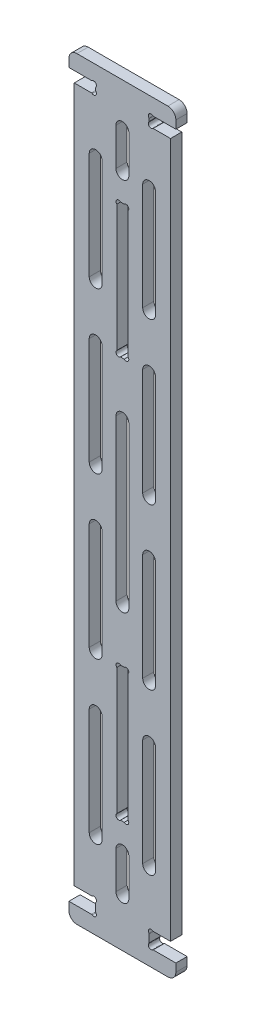
from build123d import *

# Parameters (mm, degrees)
SKETCH_1_W          = 18
SKETCH_1_H          = 130
SKETCH_1_W_2        = 5
SKETCH_1_H_2        = 2
SKETCH_1_H_3        = 3
EXTRUDE_1_DEPTH     = 1.05
SKETCH_5_R          = 0.5
CUT_EXTRUDE_3_DEPTH = 69.625141166
SKETCH_2_W          = 1.05
SKETCH_2_H          = 25.1
CUT_EXTRUDE_1_DEPTH = 10
SKETCH_6_R          = 0.5
CUT_EXTRUDE_4_DEPTH = 69.625141166
CUT_EXTRUDE_5_DEPTH = 69.625141166
CUT_EXTRUDE_6_DEPTH = 69.625141166
EXTRUDE_2_DEPTH     = 2.1
CUT_EXTRUDE_7_DEPTH = 72.731513298
FILLET_1_R          = 0.2
FILLET_2_R          = 1.5
FILLET_3_R          = 0.2


with BuildPart() as part:
    # 草图1 → 凸台-拉伸1 (new, symmetric)
    with BuildSketch(Plane.XY):
        Rectangle(SKETCH_1_W, SKETCH_1_H)
        with Locations((-2.5, 66)):
            Rectangle(SKETCH_1_W_2, SKETCH_1_H_2)
        with Locations((2.5, 66)):
            Rectangle(SKETCH_1_W_2, SKETCH_1_H_2)
        with Locations((2.5, -66.5)):
            Rectangle(SKETCH_1_W_2, SKETCH_1_H_3)
        with Locations((-2.5, -66.5)):
            Rectangle(SKETCH_1_W_2, SKETCH_1_H_3)
    extrude(amount=EXTRUDE_1_DEPTH, both=True)

    # 草图5 → 切除-拉伸3 (cut, through all)
    with BuildSketch(Plane.XY.offset(1.05)):
        with Locations((5.353553391, 65.353553391)):
            Circle(SKETCH_5_R)
        with Locations((-5.353553391, 65.353553391)):
            Circle(SKETCH_5_R)
        with Locations((5.353553391, -65.353553391)):
            Circle(SKETCH_5_R)
        with Locations((-5.353553391, -65.353553391)):
            Circle(SKETCH_5_R)
    extrude(amount=-CUT_EXTRUDE_3_DEPTH, mode=Mode.SUBTRACT)

    # 草图2 → 切除-拉伸1 (cut)
    with BuildSketch(Plane.XY.offset(1.05)):
        with Locations((0.525, 37.5)):
            Rectangle(SKETCH_2_W, SKETCH_2_H)
        with Locations((-0.525, 37.5)):
            Rectangle(SKETCH_2_W, SKETCH_2_H)
        with Locations((0.525, -37.5)):
            Rectangle(SKETCH_2_W, SKETCH_2_H)
        with Locations((-0.525, -37.5)):
            Rectangle(SKETCH_2_W, SKETCH_2_H)
    extrude(amount=-CUT_EXTRUDE_1_DEPTH, mode=Mode.SUBTRACT)

    # 草图6 → 切除-拉伸4 (cut, through all)
    with BuildSketch(Plane.XY.offset(1.05)):
        with Locations((0.696446609, 49.696446609)):
            Circle(SKETCH_6_R)
        with Locations((-0.696446609, 49.696446609)):
            Circle(SKETCH_6_R)
        with Locations((0.696446609, 25.303553391)):
            Circle(SKETCH_6_R)
        with Locations((-0.696446609, 25.303553391)):
            Circle(SKETCH_6_R)
    cut_extrude_4 = extrude(amount=-CUT_EXTRUDE_4_DEPTH, mode=Mode.SUBTRACT)

    # 镜向1: 切除-拉伸4 across plane
    add(cut_extrude_4.mirror(Plane.ZX), mode=Mode.SUBTRACT)

    # 草图4 → 切除-拉伸5 (cut, through all)
    with BuildSketch(Plane.XY.offset(1.05)):
        with BuildLine():
            Line((6.2, 55), (6.2, 35))
            ThreePointArc((6.2, 35), (5, 33.8), (3.8, 35))
            Line((3.8, 35), (3.8, 55))
            ThreePointArc((3.8, 55), (5, 56.2), (6.2, 55))
        make_face()
        with BuildLine():
            Line((6.2, 25), (6.2, 5))
            ThreePointArc((6.2, 5), (5, 3.8), (3.8, 5))
            Line((3.8, 5), (3.8, 25))
            ThreePointArc((3.8, 25), (5, 26.2), (6.2, 25))
        make_face()
        with BuildLine():
            Line((6.2, -5), (6.2, -25))
            ThreePointArc((6.2, -25), (5, -26.2), (3.8, -25))
            Line((3.8, -25), (3.8, -5))
            ThreePointArc((3.8, -5), (5, -3.8), (6.2, -5))
        make_face()
        with BuildLine():
            Line((3.8, -55), (3.8, -35))
            ThreePointArc((3.8, -35), (5, -33.8), (6.2, -35))
            Line((6.2, -35), (6.2, -55))
            ThreePointArc((6.2, -55), (5, -56.2), (3.8, -55))
        make_face()
    cut_extrude_5 = extrude(amount=-CUT_EXTRUDE_5_DEPTH, mode=Mode.SUBTRACT)

    # 镜向2: 切除-拉伸5 across plane
    add(cut_extrude_5.mirror(Plane(origin=(0, 0, 0), x_dir=(0, 0, 1), z_dir=(1, 0, 0))), mode=Mode.SUBTRACT)

    # 草图7 → 切除-拉伸6 (cut, through all)
    with BuildSketch(Plane.XY.offset(1.05)):
        with BuildLine():
            Line((1.2, 62.05), (1.2, 55.05))
            ThreePointArc((1.2, 55.05), (0, 53.85), (-1.2, 55.05))
            Line((-1.2, 55.05), (-1.2, 62.05))
            ThreePointArc((-1.2, 62.05), (0, 63.25), (1.2, 62.05))
        make_face()
        with BuildLine():
            Line((1.2, 15), (1.2, -15))
            ThreePointArc((1.2, -15), (0, -16.2), (-1.2, -15))
            Line((-1.2, -15), (-1.2, 15))
            ThreePointArc((-1.2, 15), (0, 16.2), (1.2, 15))
        make_face()
        with BuildLine():
            Line((1.2, -55.05), (1.2, -62.05))
            ThreePointArc((1.2, -62.05), (0, -63.25), (-1.2, -62.05))
            Line((-1.2, -62.05), (-1.2, -55.05))
            ThreePointArc((-1.2, -55.05), (0, -53.85), (1.2, -55.05))
        make_face()
    extrude(amount=-CUT_EXTRUDE_6_DEPTH, mode=Mode.SUBTRACT)

    # 草图8 → 凸台-拉伸2 (add)
    with BuildSketch(Plane.XY.offset(1.05)):
        Polygon((5, -68), (10, -68), (10, -71), (-10, -71), (-10, -68), (-5, -68), align=None)
        Polygon((5, 67), (10, 67), (10, 70), (-10, 70), (-10, 67), (-5, 67), align=None)
    extrude(amount=-EXTRUDE_2_DEPTH)

    # 草图9 → 切除-拉伸7 (cut, through all)
    with BuildSketch(Plane(origin=(0, 0, -1.05), x_dir=(-1, 0, 0), z_dir=(0, 0, -1))):
        with BuildLine():
            ThreePointArc((-4.853553391, -67.646446609), (-4.891613624, -67.455104893), (-5, -67.292893219))
            Line((-5, -67.292893219), (-5, -68))
            ThreePointArc((-5, -68), (-4.891613624, -67.837788326), (-4.853553391, -67.646446609))
        make_face()
        with BuildLine():
            ThreePointArc((-5.707106781, -68), (-5.353553391, -68.146446609), (-5, -68))
            Line((-5, -68), (-5.707106781, -68))
        make_face()
        with BuildLine():
            ThreePointArc((5, -67.292893219), (4.853553391, -67.646446609), (5, -68))
            Line((5, -68), (5, -67.292893219))
        make_face()
        with BuildLine():
            ThreePointArc((5, -68), (5.353553391, -68.146446609), (5.707106781, -68))
            Line((5.707106781, -68), (5, -68))
        make_face()
        with BuildLine():
            Line((5, 67), (5.707106781, 67))
            ThreePointArc((5.707106781, 67), (5.353553391, 67.146446609), (5, 67))
        make_face()
        with BuildLine():
            Line((5, 66.292893219), (5, 67))
            ThreePointArc((5, 67), (4.853553391, 66.646446609), (5, 66.292893219))
        make_face()
        with BuildLine():
            Line((-5, 67), (-5, 66.292893219))
            ThreePointArc((-5, 66.292893219), (-4.891613624, 66.455104893), (-4.853553391, 66.646446609))
            ThreePointArc((-4.853553391, 66.646446609), (-4.891613624, 66.837788326), (-5, 67))
        make_face()
        with BuildLine():
            Line((-5.707106781, 67), (-5, 67))
            ThreePointArc((-5, 67), (-5.353553391, 67.146446609), (-5.707106781, 67))
        make_face()
    extrude(amount=-CUT_EXTRUDE_7_DEPTH, mode=Mode.SUBTRACT)

    # 圆角1
    fillet_1_edges = [part.edges().sort_by_distance(p)[0] for p in [
        (5.707106781, 67, 0),
        (-5.707106781, 67, 0),
        (-5.707106781, -68, 0),
        (5, -67.292893219, 0),
        (5.707106781, -68, 0),
        (-5, -67.292893219, 0),
        (-5.707106781, -65, 0),
        (-5, -65.707106781, 0),
        (5, -65.707106781, 0),
        (5.707106781, -65, 0),
        (5.707106781, 65, 0),
        (-5.707106781, 65, 0),
    ]]
    fillet(fillet_1_edges, radius=FILLET_1_R)

    # 圆角2
    fillet_2_edges = [part.edges().sort_by_distance(p)[0] for p in [
        (10, -71, 0),
        (-10, -71, 0),
        (-10, 70, 0),
        (10, 70, 0),
    ]]
    fillet(fillet_2_edges, radius=FILLET_2_R)

    # 圆角3
    fillet_3_edges = [part.edges().sort_by_distance(p)[0] for p in [
        (-5, 66.292893219, 0),
        (5, 66.292893219, 0),
        (5, 65.707106781, 0),
        (-5, 65.707106781, 0),
    ]]
    fillet(fillet_3_edges, radius=FILLET_3_R)


solid = part.part
